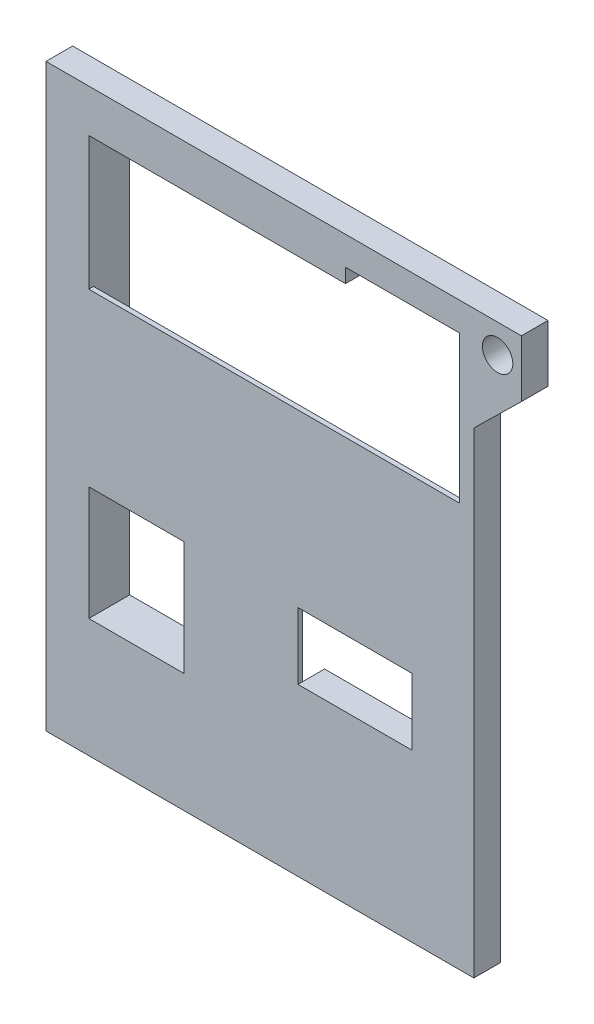
from build123d import *

# Parameters (mm, degrees)
SKETCH_1_R      = 1.6
EXTRUDE_7_DEPTH = 2.8
SKETCH_1_11_W   = 45
SKETCH_1_11_H   = 61
EXTRUDE_8_DEPTH = 0.5
EXTRUDE_9_DEPTH = 4.3


with BuildPart() as part:
    # 草图1 → 凸台-拉伸7 (new body)
    with BuildSketch(Plane.XY):
        Polygon((22.5, -30.5), (22.5, 19.601020514), (27.5, 24.5), (27.5, 30.5), (-22.5, 30.5), (-22.5, -30.5), align=None)
        Polygon((21, -18), (21, -29), (-20.5, -29), (-20.5, 29), (-18, 29), (-18, 26), (9, 26), (9, 27.5), (21, 27.5), (21, -9.279002621), (16, -9.279002621), (16, -13), (4, -13), (4, -18), align=None, mode=Mode.SUBTRACT)
        with Locations((25, 27.5)):
            Circle(SKETCH_1_R, mode=Mode.SUBTRACT)
    extrude(amount=-EXTRUDE_7_DEPTH)

    # 草图1<11> → 凸台-拉伸8 (add)
    with BuildSketch(Plane.XY):
        Rectangle(SKETCH_1_11_W, SKETCH_1_11_H)
        Polygon((21, -29), (-20.5, -29), (-20.5, 29), (21, 29), (21, 12), (-18, 12), (-18, -6), (-8, -6), (-8, -18), (4, -18), (4, -6), (16, -6), (16, -9.279002621), (21, -9.279002621), align=None, mode=Mode.SUBTRACT)
    extrude(amount=-EXTRUDE_8_DEPTH)

    # 草图1<12> → 凸台-拉伸9 (add)
    with BuildSketch(Plane.XY):
        Polygon((-20.5, -29), (21, -29), (21, -18), (16, -18), (4, -18), (-2, -18), (-8, -18), (-18, -18), (-18, -6), (-18, 12), (-18, 26), (-18, 27.5), (-18, 29), (-20.5, 29), align=None)
    extrude(amount=-EXTRUDE_9_DEPTH)


solid = part.part
